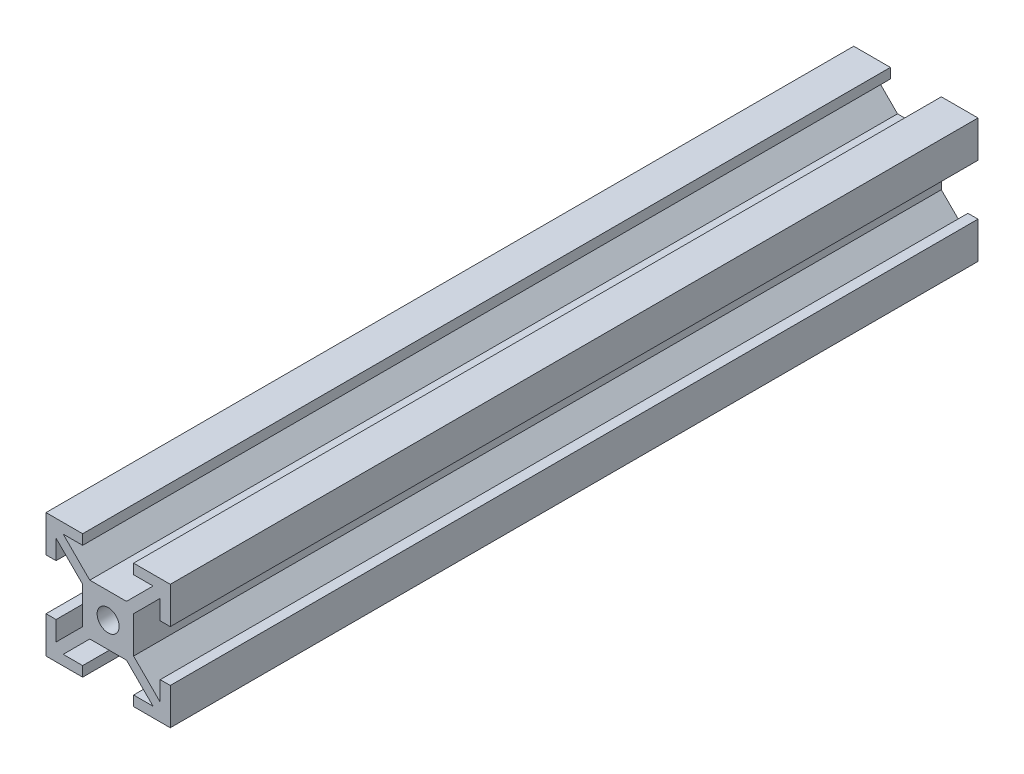
from build123d import *

# Parameters (mm, degrees)
SKETCH1_R           = 1.77
BOSS_EXTRUDE1_DEPTH = 130


with BuildPart() as part:
    # Sketch1 → Boss-Extrude1 (new body)
    with BuildSketch(Plane.XY):
        Polygon((-8.38, 4.1), (-10, 4.1), (-10, 10), (-4.1, 10), (-4.1, 8.38), (-7.234487014, 8.38), (-2.954487014, 4.1), (2.954487014, 4.1), (7.234487014, 8.38), (4.1, 8.38), (4.1, 10), (10, 10), (10, 4.1), (8.38, 4.1), (8.38, 7.234487014), (4.1, 2.954487014), (4.1, -2.954487014), (8.38, -7.234487014), (8.38, -4.1), (10, -4.1), (10, -10), (4.1, -10), (4.1, -8.38), (7.234487014, -8.38), (2.954487014, -4.1), (-2.954487014, -4.1), (-7.234487014, -8.38), (-4.1, -8.38), (-4.1, -10), (-10, -10), (-10, -4.1), (-8.38, -4.1), (-8.38, -7.234487014), (-4.1, -2.954487014), (-4.1, 2.954487014), (-8.38, 7.234487014), align=None)
        Circle(SKETCH1_R, mode=Mode.SUBTRACT)
    extrude(amount=BOSS_EXTRUDE1_DEPTH)


solid = part.part
